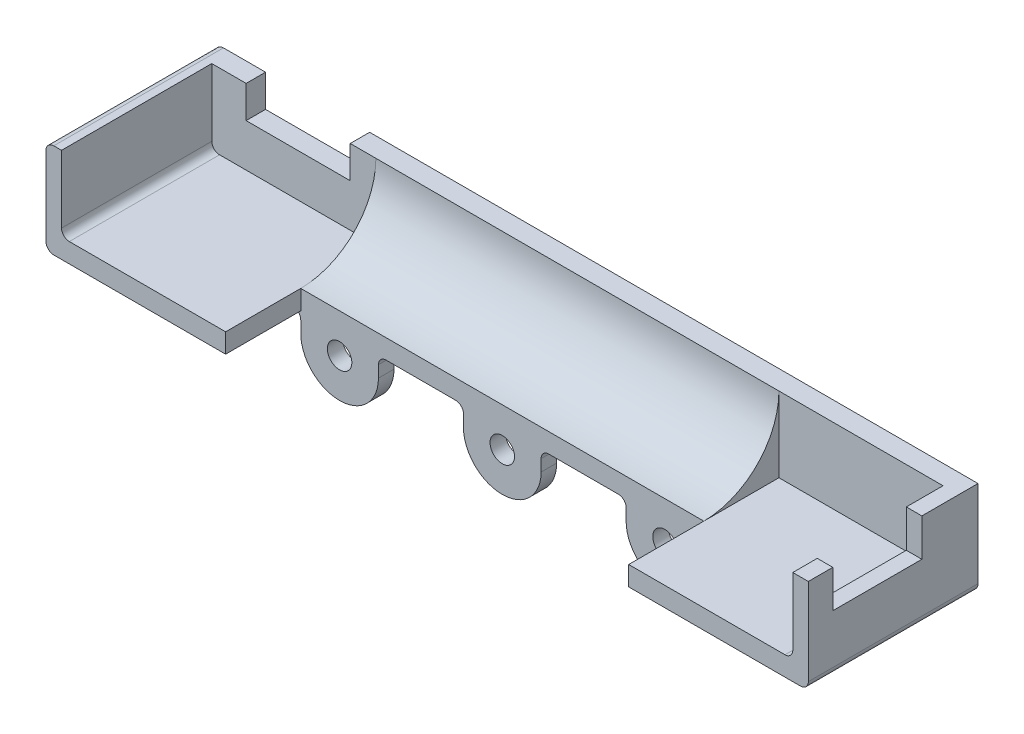
from build123d import *

# Parameters (mm, degrees)
BOSS_EXTRUDE1_DEPTH = 65.8876
BOSS_EXTRUDE2_DEPTH = 29.3624
BOSS_EXTRUDE3_DEPTH = 2.54
SKETCH4_R           = 2
BOSS_EXTRUDE4_DEPTH = 2.54
SKETCH6_W           = 24.561
SKETCH6_H           = 12.2809
BOSS_EXTRUDE5_DEPTH = 2.54
CUT_EXTRUDE1_DEPTH  = 101.281127945
FILLET1_R           = 1.27
FILLET2_R           = 1.27
FILLET4_R           = 1.27
SKETCH8_R           = 3.8
SKETCH8_R_2         = 3.80000002
CUT_EXTRUDE2_DEPTH  = 12.9159


with BuildPart() as part:
    # Sketch1 → Boss-Extrude1 (new body)
    with BuildSketch(Plane(origin=(0, 0, 0), x_dir=(0, 0, -1), z_dir=(1, 0, 0))):
        with BuildLine():
            Line((34.207401555, 10.336569156), (37.382401555, 10.336569156))
            Line((37.382401555, 10.336569156), (37.382401555, -5.119330844))
            Line((37.382401555, -5.119330844), (21.926501555, -5.119330844))
            Line((21.926501555, -5.119330844), (21.926501555, -1.944330844))
            ThreePointArc((21.926501555, -1.944330844), (30.610409224, 1.652661487), (34.207401555, 10.336569156))
        make_face()
    extrude(amount=BOSS_EXTRUDE1_DEPTH)

    # Sketch2 → Boss-Extrude2 (add)
    with BuildSketch(Plane(origin=(65.8876, 0, 0), x_dir=(0, 0, -1), z_dir=(1, 0, 0))):
        Polygon((37.382401555, -1.944330844), (37.382401555, 10.336569156), (34.207401555, 10.336569156), (34.207401555, -1.944330844), (9.646401555, -1.944330844), (9.646401555, -5.119330844), (37.382401555, -5.119330844), align=None)
    boss_extrude2 = extrude(amount=BOSS_EXTRUDE2_DEPTH)

    # Sketch3 → Boss-Extrude3 (add)
    with BuildSketch(Plane(origin=(95.25, 0, 0), x_dir=(0, 0, -1), z_dir=(1, 0, 0))):
        Polygon((28.207401555, 4.196119156), (13.646401555, 4.196119156), (13.646401555, 10.336569156), (9.646401555, 10.336569156), (9.646401555, 4.196119156), (9.646401555, -1.944330844), (28.207401555, -1.944330844), (34.207401555, -1.944330844), (34.207401555, 10.336569156), (28.207401555, 10.336569156), align=None)
    extrude(amount=-BOSS_EXTRUDE3_DEPTH)

    # Sketch4 → Boss-Extrude4 (add)
    # profile 1 of 3: a face of its own
    with BuildSketch(Plane.XY.offset(-21.926501555)):
        with BuildLine():
            Line((0, -8.294330844), (0, -5.119330844))
            Line((0, -5.119330844), (12.7, -5.119330844))
            Line((12.7, -5.119330844), (12.7, -8.294330844))
            ThreePointArc((12.7, -8.294330844), (6.35, -14.644330844), (0, -8.294330844))
        make_face()
        with Locations((6.35, -8.294330844)):
            Circle(SKETCH4_R, mode=Mode.SUBTRACT)
    # profile 2 of 3: a face of its own
    with BuildSketch(Plane.XY.offset(-21.926501555)):
        with BuildLine():
            Line((26.5938, -8.294330844), (26.5938, -5.119330844))
            Line((26.5938, -5.119330844), (39.2938, -5.119330844))
            Line((39.2938, -5.119330844), (39.2938, -8.294330844))
            ThreePointArc((39.2938, -8.294330844), (32.9438, -14.644330844), (26.5938, -8.294330844))
        make_face()
        with Locations((32.9438, -8.294330844)):
            Circle(SKETCH4_R, mode=Mode.SUBTRACT)
    # profile 3 of 3: a face of its own
    with BuildSketch(Plane.XY.offset(-21.926501555)):
        with BuildLine():
            Line((53.1876, -5.119330844), (65.8876, -5.119330844))
            Line((65.8876, -5.119330844), (65.8876, -8.294330844))
            ThreePointArc((65.8876, -8.294330844), (59.5376, -14.644330844), (53.1876, -8.294330844))
            Line((53.1876, -8.294330844), (53.1876, -5.119330844))
        make_face()
        with Locations(Location((59.5376, -8.294330844, 0), (0, 0, 180))):
            Circle(SKETCH4_R, mode=Mode.SUBTRACT)
    extrude(amount=-BOSS_EXTRUDE4_DEPTH)

    # Mirror1: Boss-Extrude2 across plane
    add(boss_extrude2.mirror(Plane(origin=(32.9438, 0, 0), x_dir=(0, 0, 1), z_dir=(1, 0, 0))))

    # Sketch6 → Boss-Extrude5 (add)
    with BuildSketch(Plane.ZY.offset(29.3624)):
        with Locations((-21.926901555, 4.196119156)):
            Rectangle(SKETCH6_W, SKETCH6_H)
    extrude(amount=-BOSS_EXTRUDE5_DEPTH)

    # Sketch7 → Cut-Extrude1 (cut, through all)
    with BuildSketch(Plane(origin=(0, 0, -37.382401555), x_dir=(-1, 0, 0), z_dir=(0, 0, -1))):
        Polygon((4.19354, 9.257069156), (4.19354, 10.336569156), (21.209, 10.336569156), (21.209, 9.257069156), (21.209, 5.066069156), (4.19354, 5.066069156), align=None)
    extrude(amount=-CUT_EXTRUDE1_DEPTH, mode=Mode.SUBTRACT)

    # Fillet1
    fillet1_edges = [part.edges().sort_by_distance(p)[0] for p in [
        (-29.3624, -5.119330844, -23.514401555),
        (-29.3624, 10.336569156, -23.514401555),
        (95.25, -5.119330844, -23.514401555),
    ]]
    fillet(fillet1_edges, radius=FILLET1_R)

    # Fillet2
    fillet2_edges = [part.edges().sort_by_distance(p)[0] for p in [
        (0, -5.119330844, -23.196501555),
        (12.7, -5.119330844, -23.196501555),
        (26.5938, -5.119330844, -23.196501555),
        (39.2938, -5.119330844, -23.196501555),
        (65.8876, -5.119330844, -23.196501555),
        (53.1876, -5.119330844, -23.196501555),
    ]]
    fillet(fillet2_edges, radius=FILLET2_R)

    # Fillet4
    fillet4_edges = [part.edges().sort_by_distance(p)[0] for p in [
        (-26.8224, -1.944330844, -21.926901555),
        (92.71, -1.944330844, -21.926901555),
    ]]
    fillet(fillet4_edges, radius=FILLET4_R)

    # Sketch8 → Cut-Extrude2 (cut)
    with BuildSketch(Plane(origin=(0, 0, -37.382401555), x_dir=(-1, 0, 0), z_dir=(0, 0, -1))):
        with Locations((-59.5376, -8.294330844)):
            Circle(SKETCH8_R)
        with Locations((-32.9438, -8.294330844)):
            Circle(SKETCH8_R_2)
        with Locations((-6.35, -8.294330844)):
            Circle(SKETCH8_R_2)
    extrude(amount=-CUT_EXTRUDE2_DEPTH, mode=Mode.SUBTRACT)


solid = part.part
